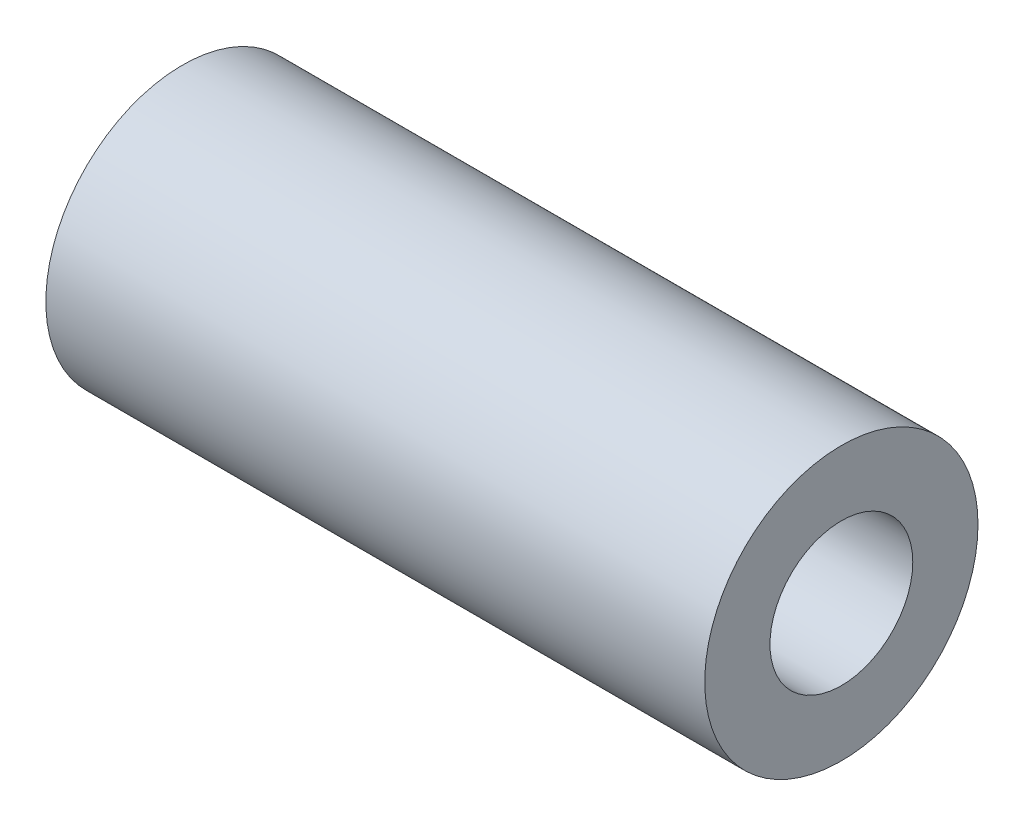
from build123d import *

# Parameters (mm, degrees)
SKETCH1_R           = 4.7625
SKETCH1_R_2         = 2.4892
BOSS_EXTRUDE1_DEPTH = 11.483975


with BuildPart() as part:
    # Sketch1 → Boss-Extrude1 (new, symmetric)
    with BuildSketch(Plane(origin=(0, 0, 0), x_dir=(0, 0, -1), z_dir=(1, 0, 0))):
        Circle(SKETCH1_R)
        Circle(SKETCH1_R_2, mode=Mode.SUBTRACT)
    extrude(amount=BOSS_EXTRUDE1_DEPTH, both=True)


solid = part.part
